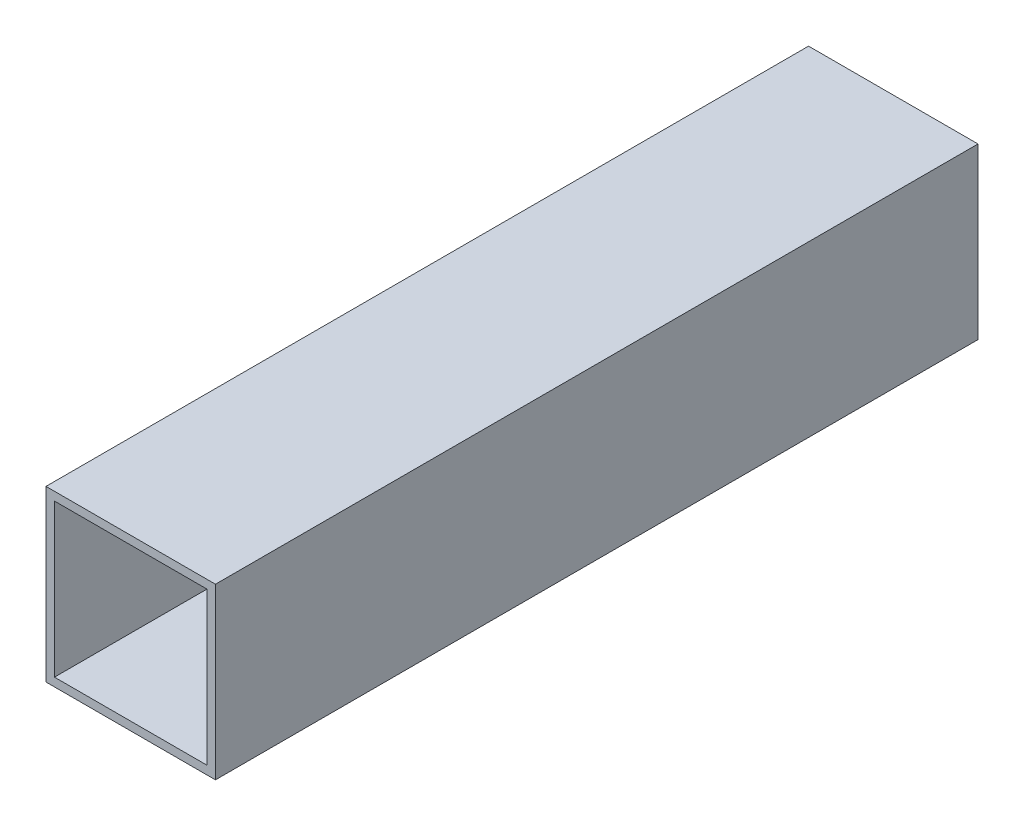
from build123d import *

# Parameters (mm, degrees)
SKETCH1_W           = 100
SKETCH1_H           = 100
SKETCH1_W_2         = 90
SKETCH1_H_2         = 90
BOSS_EXTRUDE1_DEPTH = 225


with BuildPart() as part:
    # Sketch1 → Boss-Extrude1 (new, symmetric)
    with BuildSketch(Plane.XY):
        Rectangle(SKETCH1_W, SKETCH1_H)
        Rectangle(SKETCH1_W_2, SKETCH1_H_2, mode=Mode.SUBTRACT)
    extrude(amount=BOSS_EXTRUDE1_DEPTH, both=True)


solid = part.part
